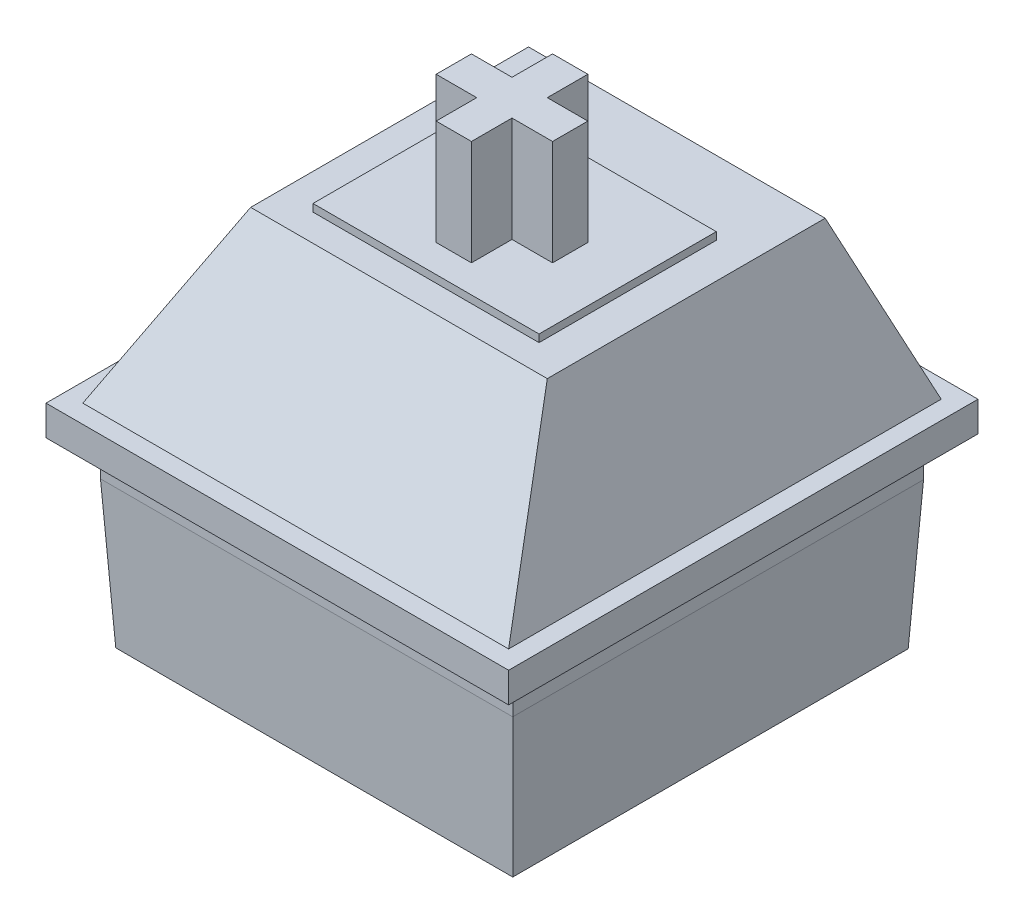
from build123d import *

# Parameters (mm, degrees)
SKETCH1_W           = 13.9446
SKETCH1_H           = 13.8938
BOSS_EXTRUDE1_DEPTH = 1.27
SKETCH2_W           = 15.6464
SKETCH2_H           = 15.875
BOSS_EXTRUDE2_DEPTH = 1.016
SKETCH6_W           = 7.6454
SKETCH6_H           = 5.9944
BOSS_EXTRUDE4_DEPTH = 0.254
BOSS_EXTRUDE5_DEPTH = 3.556
SKETCH8_W           = 13.9446
SKETCH8_H           = 13.8938
BOSS_EXTRUDE6_DEPTH = 4.953
BOSS_EXTRUDE6_TAPER = 3


with BuildPart() as part:
    # Sketch1 → Boss-Extrude1 (new body)
    with BuildSketch(Plane(origin=(0, 0, 0), x_dir=(1, 0, 0), z_dir=(0, 1, 0))):
        Rectangle(SKETCH1_W, SKETCH1_H)
    extrude(amount=BOSS_EXTRUDE1_DEPTH)

    # Sketch2 → Boss-Extrude2 (add)
    with BuildSketch(Plane(origin=(0, 1.27, 0), x_dir=(1, 0, 0), z_dir=(0, 1, 0))):
        Rectangle(SKETCH2_W, SKETCH2_H)
    extrude(amount=BOSS_EXTRUDE2_DEPTH)

    # Sketch4 → Loft1 section 0
    with BuildSketch(Plane(origin=(0, 7.366, 0), x_dir=(1, 0, 0), z_dir=(0, 1, 0))):
        with BuildLine():
            Line((-5.0165, 5.5753), (5.0165, 5.5753))
            Line((5.0165, 5.5753), (5.0165, -3.8227))
            Line((5.0165, -3.8227), (-5.0165, -3.8227))
            Line((-5.0165, -3.8227), (-5.0165, 5.5753))
        make_face()
    # Sketch3 → Loft1 section 1
    with BuildSketch(Plane(origin=(0, 2.286, 0), x_dir=(1, 0, 0), z_dir=(0, 1, 0))):
        with BuildLine():
            Line((-7.2009, -7.3152), (7.2009, -7.3152))
            Line((7.2009, -7.3152), (7.2009, 7.3152))
            Line((7.2009, 7.3152), (-7.2009, 7.3152))
            Line((-7.2009, 7.3152), (-7.2009, -7.3152))
        make_face()
    loft()

    # Sketch6 → Boss-Extrude4 (add)
    with BuildSketch(Plane(origin=(0, 7.366, 0), x_dir=(1, 0, 0), z_dir=(0, 1, 0))):
        with Locations((0, 0.0889)):
            Rectangle(SKETCH6_W, SKETCH6_H)
    extrude(amount=BOSS_EXTRUDE4_DEPTH)

    # Sketch7 → Boss-Extrude5 (add)
    with BuildSketch(Plane(origin=(0, 7.62, 0), x_dir=(1, 0, 0), z_dir=(0, 1, 0))):
        Polygon((-0.5969, 0.5969), (-0.5969, 1.9685), (0.5969, 1.9685), (0.5969, 0.5969), (1.9685, 0.5969), (1.9685, -0.5969), (0.5969, -0.5969), (0.5969, -1.9685), (-0.5969, -1.9685), (-0.5969, -0.5969), (-1.9685, -0.5969), (-1.9685, 0.5969), align=None)
    extrude(amount=BOSS_EXTRUDE5_DEPTH)

    # Sketch8 → Boss-Extrude6 (add)
    with BuildSketch(Plane.XZ):
        Rectangle(SKETCH8_W, SKETCH8_H)
    extrude(amount=BOSS_EXTRUDE6_DEPTH, taper=BOSS_EXTRUDE6_TAPER)


solid = part.part
